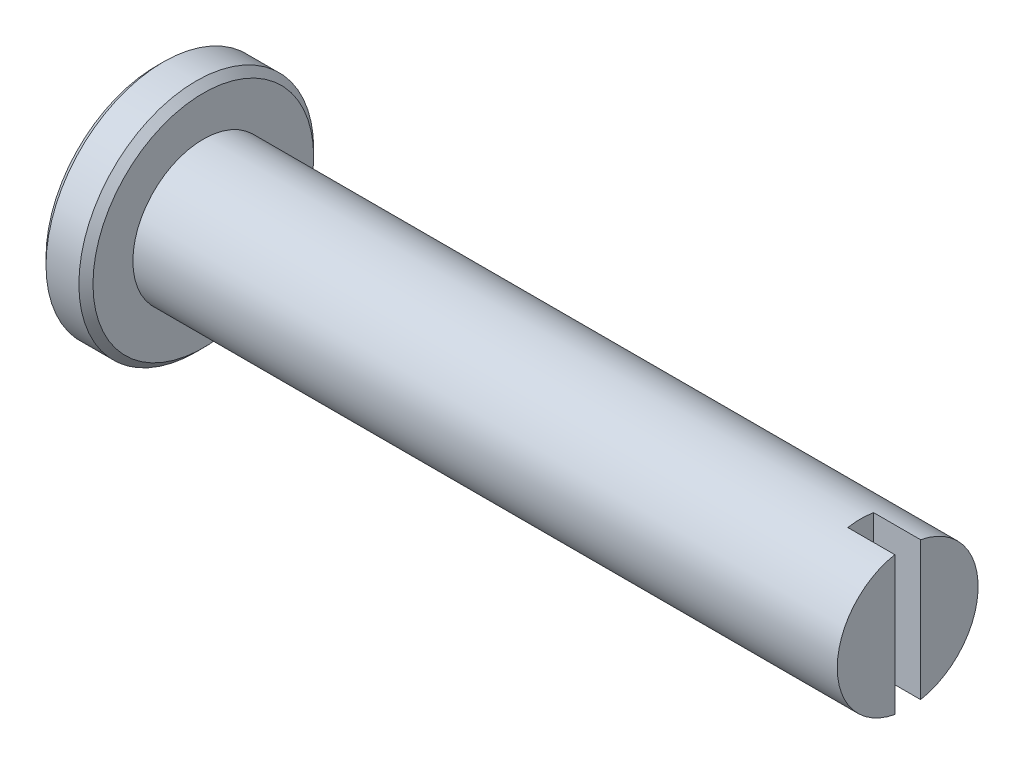
from build123d import *

# Parameters (mm, degrees)
ESBO_O3_W                = 1.1
ESBO_O3_H                = 7.097813332
CORTE_EXTRUS_O1_DEPTH    = 2
ESBO_O4_R                = 1
RESSALTO_EXTRUS_O1_DEPTH = 2
ESBO_O8_R                = 1
CORTE_EXTRUS_O2_DEPTH    = 2
CHANFRO2_SIZE            = 3.4
CHANFRO2_SIZE2           = 1.962990915
CHANFRO3_SIZE            = 0.3


with BuildPart() as part:
    # Esboço1 → Revolução1 (revolve)
    with BuildSketch(Plane(origin=(0, 0, 0), x_dir=(1, 0, 0), z_dir=(0, 1, 0)), mode=Mode.PRIVATE) as revolu_o1_sk:
        Polygon((0, 0), (32, 0), (32, 3), (2, 3), (2, 5), (0, 5), align=None)
    revolve(revolu_o1_sk.sketch.rotate(Axis((0, 0, 0), (1, 0, 0)), 180), axis=Axis((0, 0, 0), (1, 0, 0)))

    # Esboço3 → Corte-extrusão1 (cut)
    with BuildSketch(Plane(origin=(32, 0, 0), x_dir=(0, 0, -1), z_dir=(1, 0, 0))):
        with Locations((0, 0.230257265)):
            Rectangle(ESBO_O3_W, ESBO_O3_H)
    extrude(amount=-CORTE_EXTRUS_O1_DEPTH, mode=Mode.SUBTRACT)


with BuildPart() as body_2:
    # Esboço4 → Ressalto-extrusão1 (new body)
    with BuildSketch(Plane.ZY):
        Circle(ESBO_O4_R)
    extrude(amount=-RESSALTO_EXTRUS_O1_DEPTH)


with BuildPart() as corte_extrus_o2_tool:
    # Esboço8 → Corte-extrusão2 (new body)
    with BuildSketch(Plane.ZY):
        Circle(ESBO_O8_R)
    extrude(amount=-CORTE_EXTRUS_O2_DEPTH)


with BuildPart() as part_1:
    add(part.part)

    # Corte-extrusão2: cut by corte_extrus_o2_tool
    add(corte_extrus_o2_tool.part, mode=Mode.SUBTRACT)

    # Chanfro2
    chanfro2_edges = [part_1.edges().sort_by_distance(p)[0] for p in [
        (0, 0, -1),
    ]]
    chanfro2_side = [part_1.faces().sort_by_distance(p)[0] for p in [
        (0, 0, -4.858578644),
    ]]
    chamfer(chanfro2_edges, length=CHANFRO2_SIZE, length2=CHANFRO2_SIZE2, reference=chanfro2_side[0])

    # Chanfro3
    chanfro3_edges = [part_1.edges().sort_by_distance(p)[0] for p in [
        (0, 0, -5),
        (2, 0, -5),
    ]]
    chamfer(chanfro3_edges, length=CHANFRO3_SIZE)


with BuildPart() as body_2_1:
    add(body_2.part)

    # Corte-extrusão2: cut by corte_extrus_o2_tool
    add(corte_extrus_o2_tool.part, mode=Mode.SUBTRACT)


solid = part_1.part
